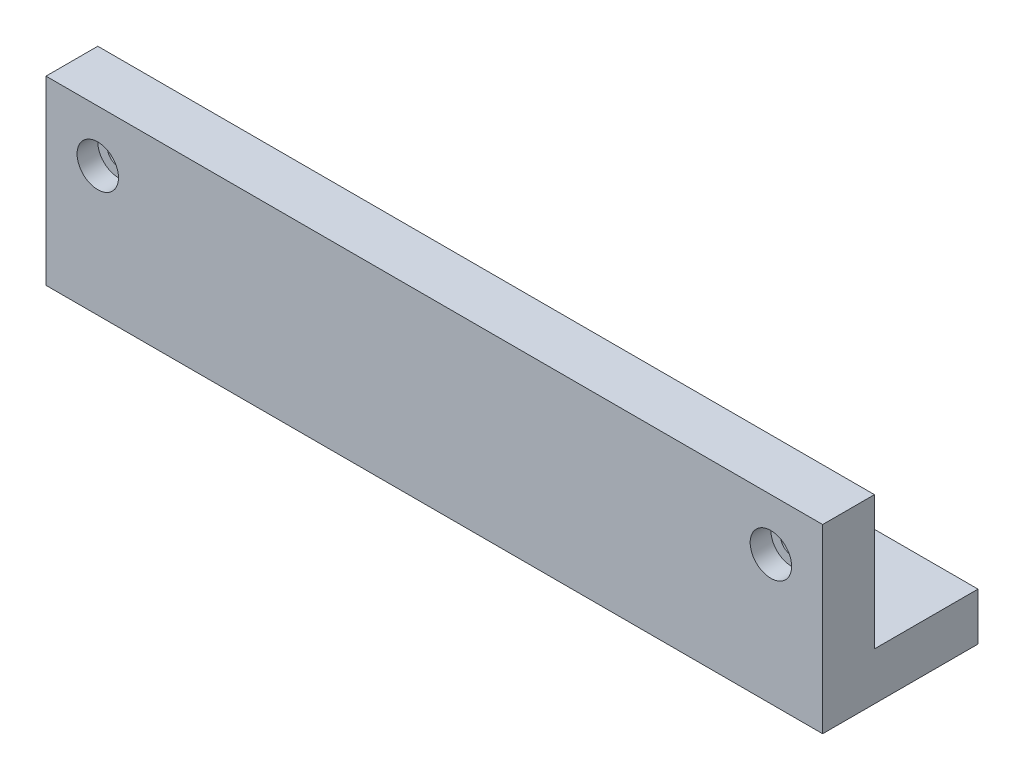
from build123d import *

# Parameters (mm, degrees)
SKETCH_1_W                   = 50
SKETCH_1_H                   = 5.1
EXTRUDE_1_DEPTH              = 4
SKETCH_3_W                   = 50
SKETCH_3_H                   = 25
EXTRUDE_2_DEPTH              = 10
SKETCH_4_W                   = 10
SKETCH_4_H                   = 25
EXTRUDE_3_DEPTH              = 50
SKETCH_5_W                   = 150
SKETCH_5_H                   = 30
EXTRUDE_4_DEPTH              = 10
CUT_EXTRUDE_START            = -20
SKETCH_6_W                   = 150
SKETCH_6_H                   = 0.8
CUT_EXTRUDE_1_DEPTH          = 20
HOLE_WIZARD_M4_1_D           = 4.3
HOLE_WIZARD_M4_1_CBORE_D     = 8
HOLE_WIZARD_M4_1_CBORE_DEPTH = 4


with BuildPart() as part:
    # 스케치1 → 보스-돌출1 (new body)
    with BuildSketch(Plane.XY):
        Rectangle(SKETCH_1_W, SKETCH_1_H)
    extrude(amount=EXTRUDE_1_DEPTH)

    # 스케치3 → 보스-돌출2 (add)
    with BuildSketch(Plane.XY.offset(4)):
        with Locations((0, -2.5)):
            Rectangle(SKETCH_3_W, SKETCH_3_H)
    extrude(amount=EXTRUDE_2_DEPTH)

    # 스케치4 → 보스-돌출3 (add)
    with BuildSketch(Plane.ZY.offset(25)):
        with Locations((9, -2.5)):
            Rectangle(SKETCH_4_W, SKETCH_4_H)
    extrude_3 = extrude(amount=EXTRUDE_3_DEPTH)

    # 대칭 복사1: 보스-돌출3 across plane
    add(extrude_3.mirror(Plane.ZY))

    # 스케치5 → 보스-돌출4 (add)
    with BuildSketch(Plane.XZ.offset(15)):
        with Locations((0, -1)):
            Rectangle(SKETCH_5_W, SKETCH_5_H)
    extrude(amount=EXTRUDE_4_DEPTH)

    # 스케치6 → 컷-돌출1 (cut)
    with BuildSketch(Plane(origin=(0, 0, -16), x_dir=(-1, 0, 0), z_dir=(0, 0, -1)).offset(CUT_EXTRUDE_START)):
        with Locations((0, -15.4)):
            Rectangle(SKETCH_6_W, SKETCH_6_H)
    extrude(amount=CUT_EXTRUDE_1_DEPTH, mode=Mode.SUBTRACT)

    # M4 소켓 머리 캡 나사용 카운터보어1 (through all)
    with Locations(Plane.XY.offset(14)):
        with Locations((-65, 0), (65, 0)):
            CounterBoreHole(HOLE_WIZARD_M4_1_D / 2, HOLE_WIZARD_M4_1_CBORE_D / 2, HOLE_WIZARD_M4_1_CBORE_DEPTH)


solid = part.part
